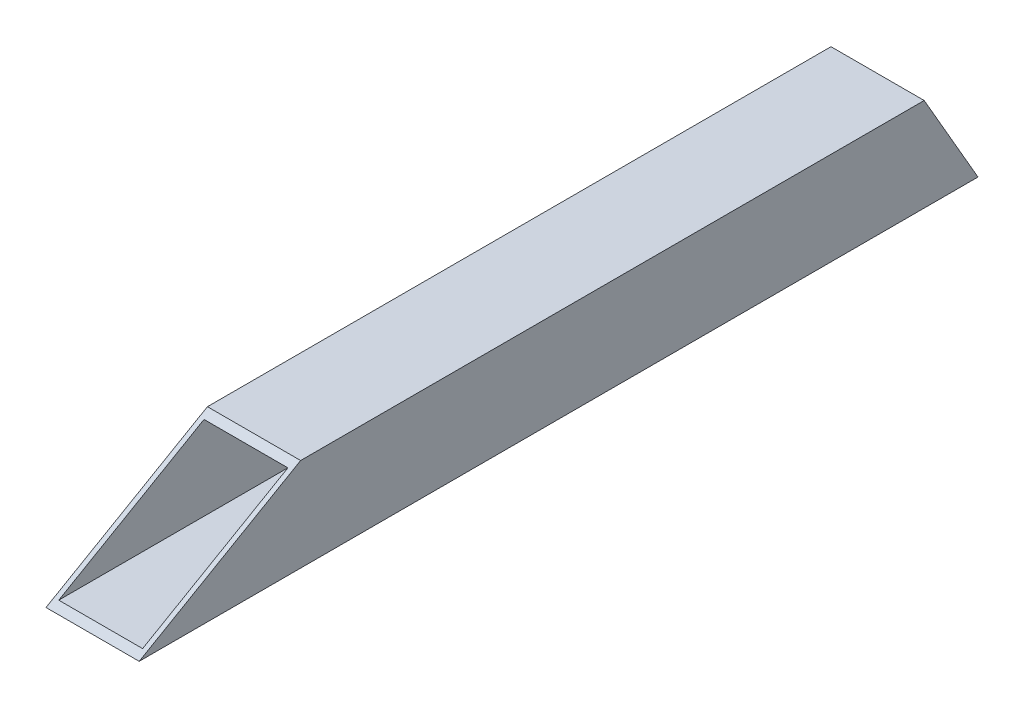
from build123d import *

# Parameters (mm, degrees)
SKETCH_1_W          = 20
SKETCH_1_H          = 20
SKETCH_1_W_2        = 18
SKETCH_1_H_2        = 18
EXTRUDE_1_DEPTH     = 180
CUT_EXTRUDE_1_DEPTH = 250


with BuildPart() as part:
    # 草图1 → 凸台-拉伸1 (new body)
    with BuildSketch(Plane.XY):
        with Locations((10, 10)):
            Rectangle(SKETCH_1_W, SKETCH_1_H)
        with Locations((10, 10)):
            Rectangle(SKETCH_1_W_2, SKETCH_1_H_2, mode=Mode.SUBTRACT)
    extrude(amount=EXTRUDE_1_DEPTH)

    # 草图2 → 切除-拉伸1 (cut)
    with BuildSketch(Plane(origin=(20, 0, 0), x_dir=(0, 0, -1), z_dir=(1, 0, 0))):
        Polygon((-180, 20), (-180, 0), (-145.358983849, 20), align=None)
        Polygon((-11.547005384, 20), (0, 20), (0, 0), align=None)
    extrude(amount=-CUT_EXTRUDE_1_DEPTH, mode=Mode.SUBTRACT)


solid = part.part
